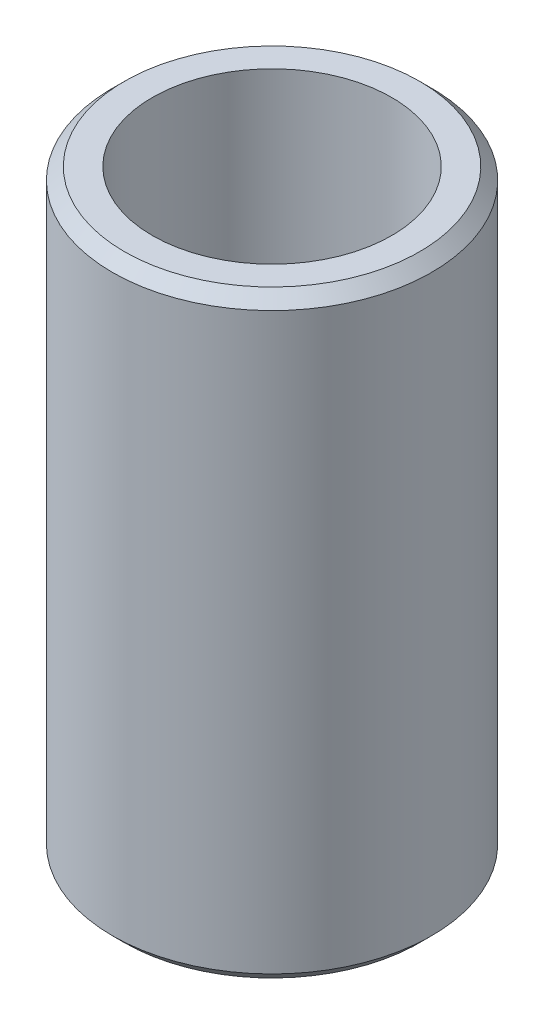
from build123d import *

# Parameters (mm, degrees)
SKETCH1_R           = 4
SKETCH1_R_2         = 3
BOSS_EXTRUDE1_DEPTH = 15
CHAMFER1_SIZE       = 0.3


with BuildPart() as part:
    # Sketch1 → Boss-Extrude1 (new body)
    with BuildSketch(Plane(origin=(0, 0, 0), x_dir=(1, 0, 0), z_dir=(0, 1, 0))):
        Circle(SKETCH1_R)
        Circle(SKETCH1_R_2, mode=Mode.SUBTRACT)
    extrude(amount=BOSS_EXTRUDE1_DEPTH)

    # Chamfer1
    chamfer1_edges = [part.edges().sort_by_distance(p)[0] for p in [
        (-4, 0, 0),
        (-4, 15, 0),
    ]]
    chamfer(chamfer1_edges, length=CHAMFER1_SIZE)


solid = part.part
